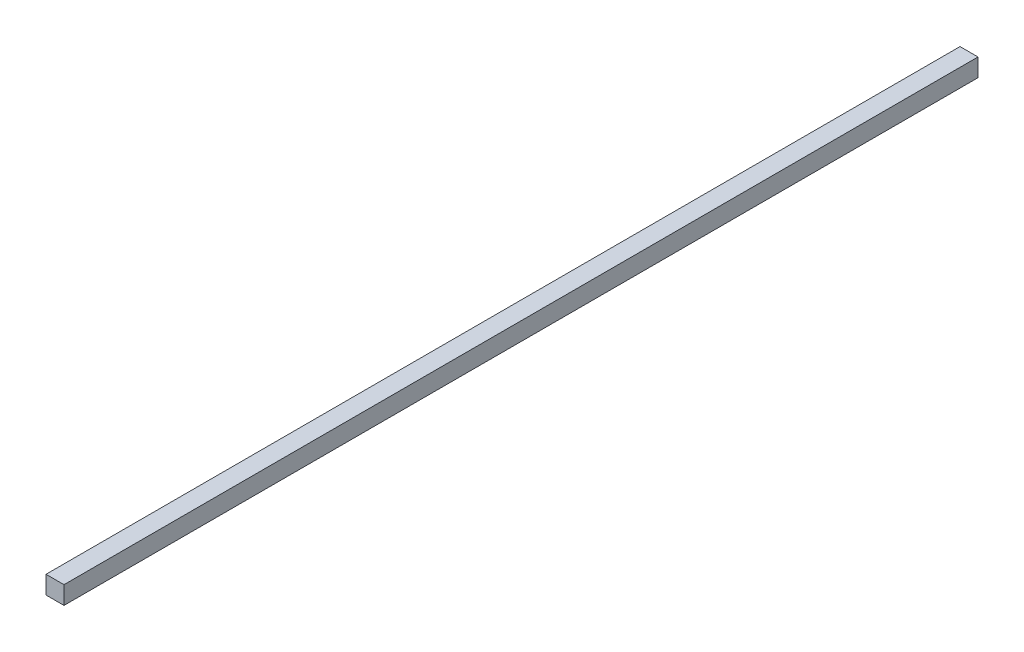
from build123d import *

# Parameters (mm, degrees)
SKETCH3_W           = 6
SKETCH3_H           = 6
BOSS_EXTRUDE1_DEPTH = 152.4


with BuildPart() as part:
    # Sketch3 → Boss-Extrude1 (new, symmetric)
    with BuildSketch(Plane.XY):
        Rectangle(SKETCH3_W, SKETCH3_H)
    extrude(amount=BOSS_EXTRUDE1_DEPTH, both=True)


solid = part.part
